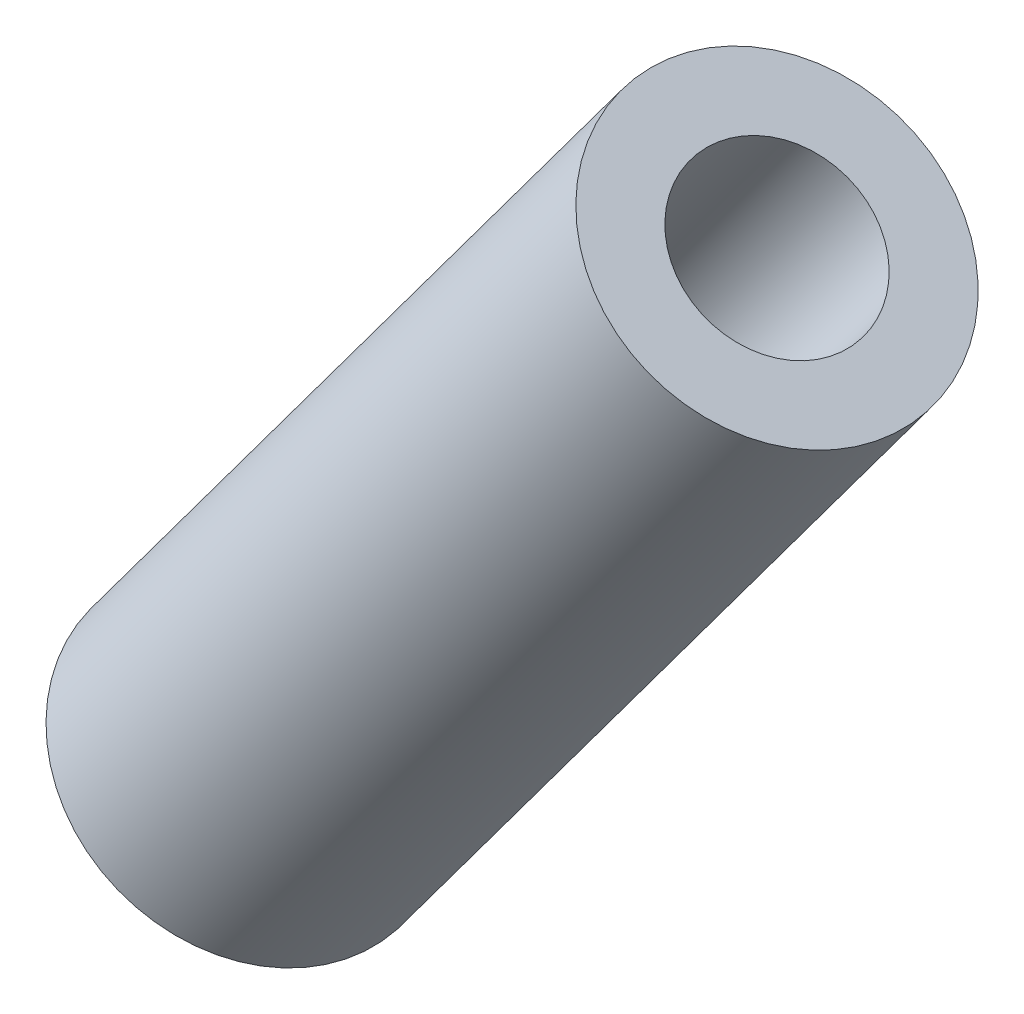
from build123d import *

# Parameters (mm, degrees)
SWEEP1_PROFILE_R     = 8.96875
CUT_SWEEP1_PROFILE_R = 5


with BuildPart() as part:
    # Sweep1: sweep along a curve in space
    with BuildLine() as sweep1_path:
        Line((0, 0, 0), (30.290133782, 40.78170908, 0))
    # Sweep1 profile (on start of the path) → Sweep1 (sweep)
    with BuildSketch(Plane(origin=(0, 0, 0), x_dir=(0.8027895488189021, -0.5962624760180233, 0), z_dir=(0.5962624760180233, 0.8027895488189021, 0))):
        Circle(SWEEP1_PROFILE_R)
    sweep(path=sweep1_path.line)

    # Cut-Sweep1: sweep along a curve in space
    with BuildLine() as cut_sweep1_path:
        Line((0, 0, 0), (30.290133782, 40.78170908, 0))
    # Cut-Sweep1 profile (on start of the path) → Cut-Sweep1 (sweep, cut)
    with BuildSketch(Plane(origin=(0, 0, 0), x_dir=(0.8027895488189021, -0.5962624760180233, 0), z_dir=(0.5962624760180233, 0.8027895488189021, 0))):
        Circle(CUT_SWEEP1_PROFILE_R)
    sweep(path=cut_sweep1_path.line, mode=Mode.SUBTRACT)


solid = part.part
